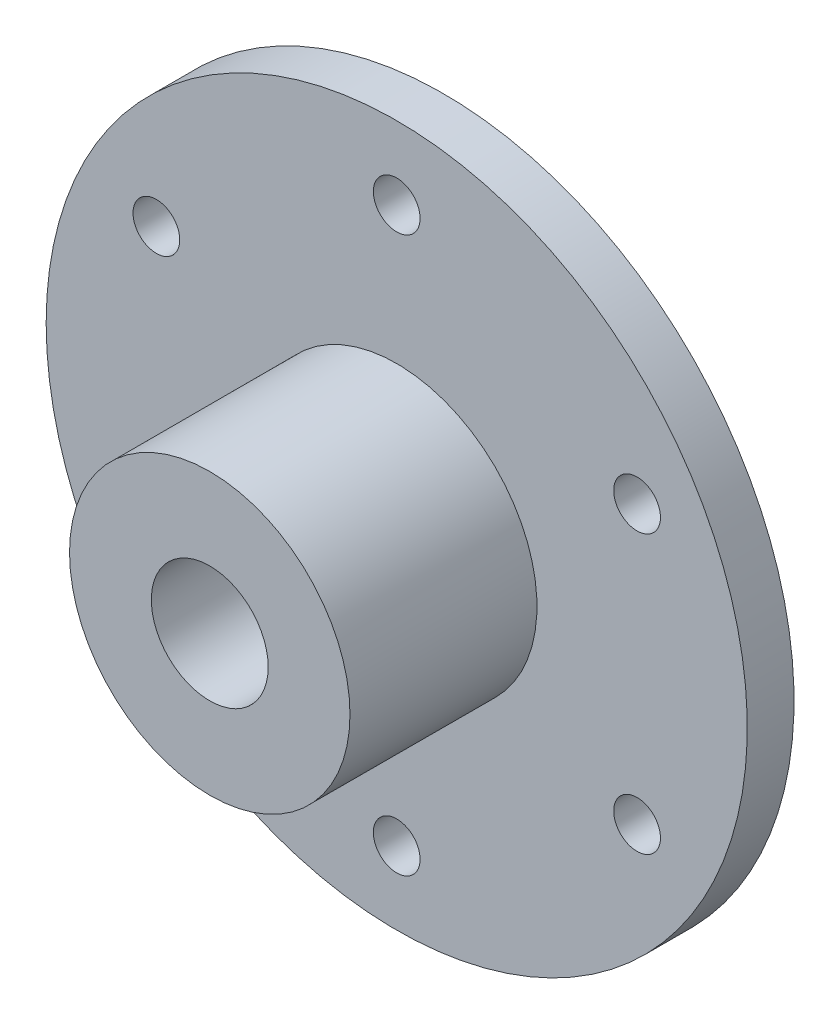
from build123d import *

# Parameters (mm, degrees)
SKETCH1_R                  = 30
BOSS_EXTRUDE1_DEPTH        = 4
SKETCH2_R                  = 12
BOSS_EXTRUDE2_DEPTH        = 16
F_4_0_4_DIAMETER_HOLE1_D   = 4
F_10_0_10_DIAMETER_HOLE1_D = 10
SKETCH7_W                  = 2
SKETCH7_H                  = 24


with BuildPart() as part:
    # Sketch1 → Boss-Extrude1 (new body)
    with BuildSketch(Plane.XY):
        with Locations(Location((0, 0, 0), (0, 0, 180))):
            Circle(SKETCH1_R)
    extrude(amount=-BOSS_EXTRUDE1_DEPTH)

    # Sketch2 → Boss-Extrude2 (add)
    with BuildSketch(Plane.XY):
        with Locations(Location((0, 0, 0), (0, 0, 180))):
            Circle(SKETCH2_R)
    extrude(amount=BOSS_EXTRUDE2_DEPTH)

    # Ø4.0 (4) Diameter Hole1 (through all)
    with Locations(Plane.XY):
        with Locations((20.56810334, -11.875), (0, 23.75), (0, -23.75), (20.56810334, 11.875), (-20.56810334, 11.875), (-20.56810334, -11.875)):
            Hole(F_4_0_4_DIAMETER_HOLE1_D / 2)

    # Ø10.0 (10) Diameter Hole1 (through all)
    with Locations(Plane.XY.offset(16)):
        with Locations((0, 0)):
            Hole(F_10_0_10_DIAMETER_HOLE1_D / 2)

    # Sketch7 → Ø4.0 (4) Diameter Hole2 (revolve, cut)
    with BuildSketch(Plane(origin=(0, -4.582575695, 8), x_dir=(0, 0, 1), z_dir=(1, 0, 0))):
        with Locations((1, 12)):
            Rectangle(SKETCH7_W, SKETCH7_H)
    revolve(axis=Axis((0, 1.767424305, 8), (0, -1, 0)), mode=Mode.SUBTRACT)


solid = part.part
